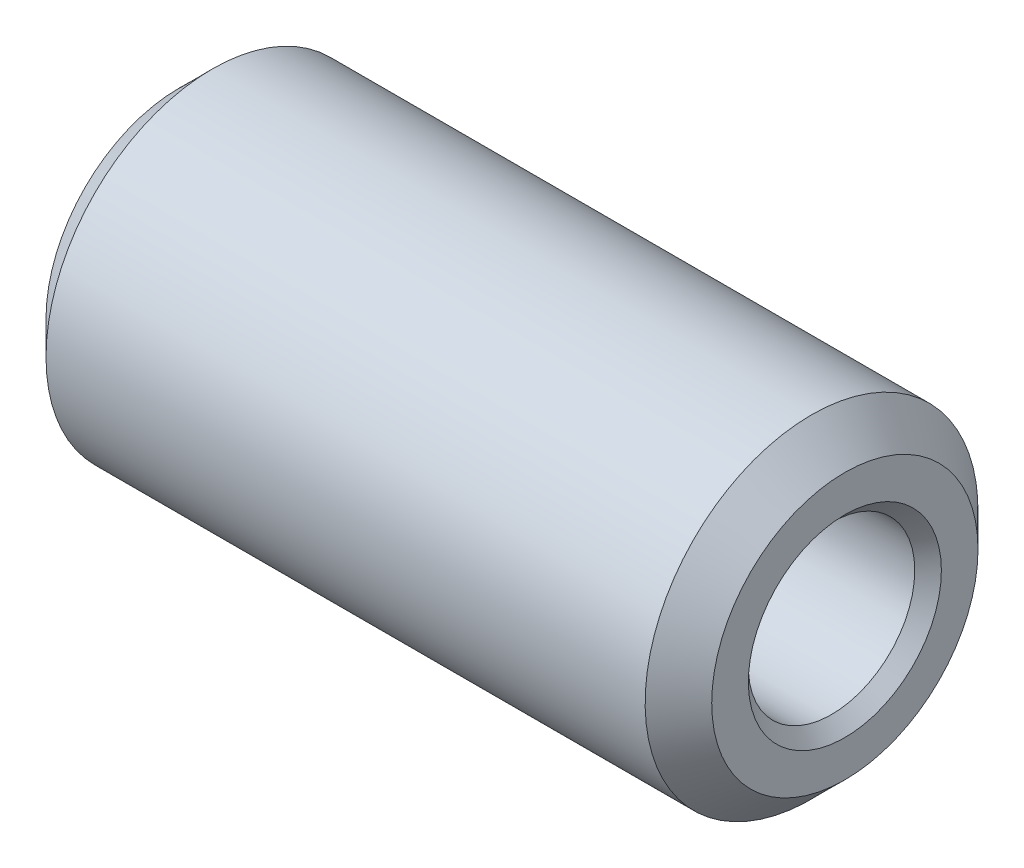
from build123d import *

# Parameters (mm, degrees)
SKETCH_1_W        = 10
SKETCH_1_H        = 2.5
HOLE_WIZARD_M31_D = 2.5
CHAMFER_1_SIZE    = 0.2
CHAMFER_2_SIZE    = 0.5


with BuildPart() as part:
    # Эскиз1 → Повернуть1 (revolve)
    with BuildSketch(Plane.XY):
        with Locations((5, 1.25)):
            Rectangle(SKETCH_1_W, SKETCH_1_H)
    revolve(axis=Axis((10, 0, 0), (-1, 0, 0)))

    # Отверстие обработанное метчиком M31 (through all)
    with Locations(Plane(origin=(10, 0, 0), x_dir=(0, 0, -1), z_dir=(1, 0, 0))):
        with Locations((0, 0)):
            Hole(HOLE_WIZARD_M31_D / 2)

    # Фаска1
    chamfer_1_edges = [part.edges().sort_by_distance(p)[0] for p in [
        (10, 0, -1.25),
        (0, 0, -1.25),
    ]]
    chamfer(chamfer_1_edges, length=CHAMFER_1_SIZE)

    # Фаска2
    chamfer_2_edges = [part.edges().sort_by_distance(p)[0] for p in [
        (10, -2.5, 0),
        (0, -2.5, 0),
    ]]
    chamfer(chamfer_2_edges, length=CHAMFER_2_SIZE)


solid = part.part
